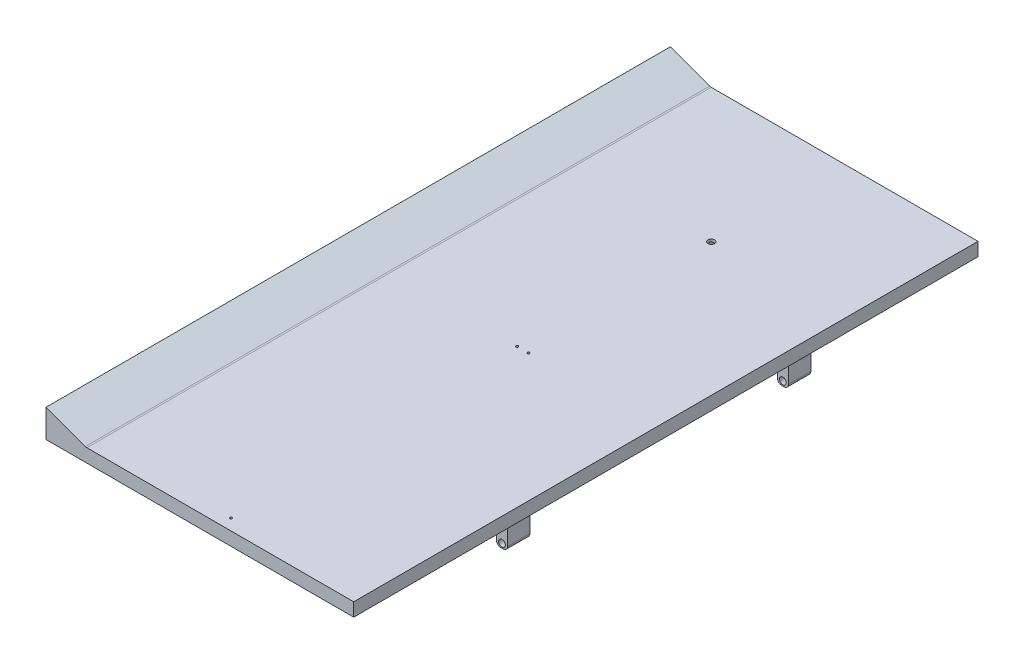
from build123d import *

# Parameters (mm, degrees)
BOSS_EXTRUDE1_DEPTH      = 1040
BOSS_EXTRUDE1_DEPTH_BACK = 360
SKETCH2_R                = 7.5
BOSS_EXTRUDE2_DEPTH      = 680
SKETCH4_W                = 580
SKETCH4_H                = 10
CUT_EXTRUDE1_DEPTH       = 1252.319303775
CUT_EXTRUDE2_DEPTH       = 1252.319303775
CUT_EXTRUDE2_DEPTH_BACK  = 1252.319303775
SKETCH5_W                = 580
SKETCH5_H                = 50
CUT_EXTRUDE3_DEPTH       = 1252.319303775
CUT_EXTRUDE3_DEPTH_BACK  = 1252.319303775
SKETCH6_R                = 7.5
SKETCH8_W                = 25
SKETCH8_H                = 32
BOSS_EXTRUDE4_DEPTH      = 37.5
SKETCH9_W                = 16.002
SKETCH9_H                = 32.5
CUT_EXTRUDE4_DEPTH       = 66.8
SKETCH11_W               = 16.002
SKETCH11_H               = 64
CUT_EXTRUDE5_DEPTH       = 24
SKETCH13_R               = 2.5908
CUT_EXTRUDE6_DEPTH       = 20


with BuildPart() as part:
    # Sketch1 → Boss-Extrude1 (new, two sides: drawn at the far end of the back side and taken through both)
    with BuildSketch(Plane.XY.offset(-BOSS_EXTRUDE1_DEPTH_BACK)):
        with BuildLine():
            Line((0, 0), (-598.236730193, 0))
            ThreePointArc((-598.236730193, 0), (-599.97321197, 0.15192247), (-601.656931626, 0.603073792))
            Line((-601.656931626, 0.603073792), (-690, 32.757321084))
            Line((-690, 32.757321084), (-690, -30))
            Line((-690, -30), (-656.445665216, -30))
            Line((-656.445665216, -30), (-26.446144718, -30))
            Line((-26.446144718, -30), (0, -30))
            Line((0, -30), (0, -20.000479502))
            Line((0, -20.000479502), (0, 0))
        make_face()
    extrude(amount=BOSS_EXTRUDE1_DEPTH + BOSS_EXTRUDE1_DEPTH_BACK)

    # Sketch2 → Boss-Extrude2 (add)
    # profile 1 of 2: a face of its own
    with BuildSketch(Plane.XY):
        with BuildLine():
            Line((-690, -30), (-690, -80))
            ThreePointArc((-690, -80), (-687.071067812, -87.071067812), (-680, -90))
            Line((-680, -90), (-350, -90))
            ThreePointArc((-350, -90), (-342.928932188, -87.071067812), (-340, -80))
            Line((-340, -80), (-340, -30))
            Line((-340, -30), (-690, -30))
        make_face()
        with BuildLine():
            Line((-677.5, -72.5), (-352.5, -72.5))
            ThreePointArc((-352.5, -72.5), (-345, -80), (-352.5, -87.5))
            Line((-352.5, -87.5), (-677.5, -87.5))
            ThreePointArc((-677.5, -87.5), (-685, -80), (-677.5, -72.5))
        make_face(mode=Mode.SUBTRACT)
    # profile 2 of 2: a face of its own
    with BuildSketch(Plane.XY):
        with BuildLine():
            Line((-15, -30), (-15, -80))
            ThreePointArc((-15, -80), (-17.928932188, -87.071067812), (-25, -90))
            Line((-25, -90), (-30, -90))
            ThreePointArc((-30, -90), (-37.071067812, -87.071067812), (-40, -80))
            Line((-40, -80), (-40, -30))
            Line((-40, -30), (-15, -30))
        make_face()
        with Locations((-27.5, -80)):
            Circle(SKETCH2_R, mode=Mode.SUBTRACT)
    extrude(amount=BOSS_EXTRUDE2_DEPTH)

    # Sketch4 → Cut-Extrude1 (cut, through all)
    with BuildSketch(Plane(origin=(0, 0, 0), x_dir=(0, 0, -1), z_dir=(1, 0, 0))):
        with Locations((-340, -85)):
            Rectangle(SKETCH4_W, SKETCH4_H)
    extrude(amount=-CUT_EXTRUDE1_DEPTH, mode=Mode.SUBTRACT)

    # Sketch5 → Cut-Extrude2 (cut, two sides: drawn at the far end of the back side and taken through both)
    with BuildSketch(Plane.ZY.offset(690).offset(-CUT_EXTRUDE2_DEPTH_BACK)):
        with Locations((340, -55)):
            Rectangle(SKETCH5_W, SKETCH5_H)
    extrude(amount=CUT_EXTRUDE2_DEPTH + CUT_EXTRUDE2_DEPTH_BACK, mode=Mode.SUBTRACT)

    # Sketch6 → Cut-Extrude3 (cut, two sides: drawn at the far end of the back side and taken through both)
    with BuildSketch(Plane(origin=(0, 0, 0), x_dir=(1, 0, 0), z_dir=(0, 1, 0)).offset(-CUT_EXTRUDE3_DEPTH_BACK)):
        with Locations((-298.236730193, 60)):
            Circle(SKETCH6_R)
    extrude(amount=CUT_EXTRUDE3_DEPTH + CUT_EXTRUDE3_DEPTH_BACK, mode=Mode.SUBTRACT)

    # Sketch8 → Boss-Extrude4 (add)
    with BuildSketch(Plane.XZ.offset(30)):
        with Locations((-298.236730193, -60)):
            Rectangle(SKETCH8_W, SKETCH8_H)
    extrude(amount=BOSS_EXTRUDE4_DEPTH)

    # Sketch9 → Cut-Extrude4 (cut)
    with BuildSketch(Plane.XY.offset(-44)):
        with Locations((-298.237730193, -46.25)):
            Rectangle(SKETCH9_W, SKETCH9_H)
    extrude(amount=-CUT_EXTRUDE4_DEPTH, mode=Mode.SUBTRACT)

    # Sketch11 → Cut-Extrude5 (cut)
    with BuildSketch(Plane.XZ.offset(30)):
        with Locations((-298.237730193, -60)):
            Rectangle(SKETCH11_W, SKETCH11_H)
    extrude(amount=-CUT_EXTRUDE5_DEPTH, mode=Mode.SUBTRACT)

    # Sketch13 → Cut-Extrude6 (cut)
    with BuildSketch(Plane(origin=(0, 0, 0), x_dir=(1, 0, 0), z_dir=(0, 1, 0))):
        with Locations(Location((-300, -1015, 0), (0, 0, 180))):
            Circle(SKETCH13_R)
        with Locations(Location((-287.3, -360.9, 0), (0, 0, 180))):
            Circle(SKETCH13_R)
        with Locations(Location((-312.7, -360.9, 0), (0, 0, 180))):
            Circle(SKETCH13_R)
    extrude(amount=-CUT_EXTRUDE6_DEPTH, mode=Mode.SUBTRACT)


solid = part.part
